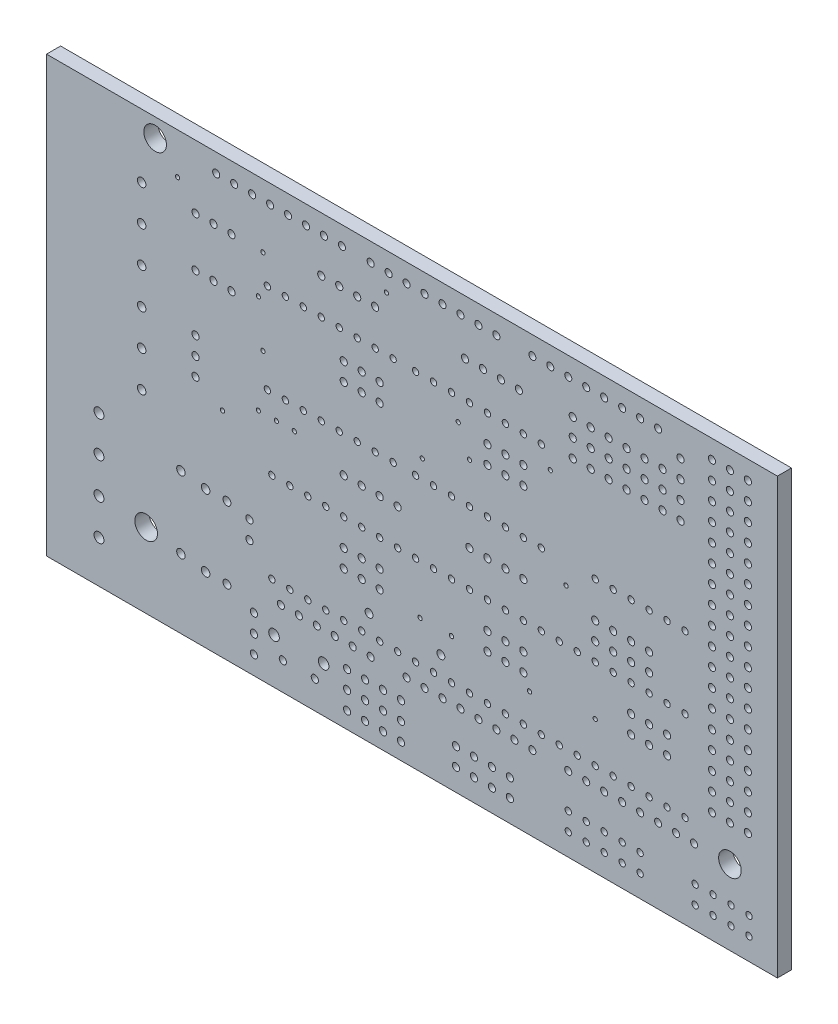
from build123d import *

# Parameters (mm, degrees)
SKETCH1_W           = 131.785247706
SKETCH1_H           = 94.524612159
SKETCH1_R           = 0.510484
SKETCH1_R_2         = 0.5615324
SKETCH1_R_3         = 0.602932652
SKETCH1_R_4         = 0.452212251
SKETCH1_R_5         = 0.7529639
SKETCH1_R_6         = 1.607820406
SKETCH1_R_7         = 0.502443877
SKETCH1_R_8         = 0.7019155
SKETCH1_R_9         = 0.301466326
BOSS_EXTRUDE1_DEPTH = 2
SKETCH4_W           = 136.062514885
SKETCH4_H           = 102.860022968
SKETCH4_W_2         = 103.854835648
SKETCH4_H_2         = 61.764941155
CUT_EXTRUDE1_DEPTH  = 10


with BuildPart() as part:
    # Sketch1 → Boss-Extrude1 (new body)
    with BuildSketch(Plane(origin=(-1.669568433, 0, 0), x_dir=(-1, 0, 0), z_dir=(0, 0, -1))):
        with Locations((-33.736575694, -25.94456792)):
            Rectangle(SKETCH1_W, SKETCH1_H)
        with Locations(Location((-14.63831, -51.3453967, 0), (0, 0, 180))):
            Circle(SKETCH1_R, mode=Mode.SUBTRACT)
        with Locations(Location((-14.000205, -37.600615, 0), (0, 0, 180))):
            Circle(SKETCH1_R, mode=Mode.SUBTRACT)
        with Locations(Location((-14.000205, -40.153035, 0), (0, 0, 180))):
            Circle(SKETCH1_R, mode=Mode.SUBTRACT)
        with Locations(Location((-43.353035, -50.841242702, 0), (0, 0, 180))):
            Circle(SKETCH1_R, mode=Mode.SUBTRACT)
        with Locations(Location((-45.905455, -50.841242702, 0), (0, 0, 180))):
            Circle(SKETCH1_R, mode=Mode.SUBTRACT)
        with Locations(Location((-48.457875, -50.841242702, 0), (0, 0, 180))):
            Circle(SKETCH1_R, mode=Mode.SUBTRACT)
        with Locations(Location((-51.010295, -50.841242702, 0), (0, 0, 180))):
            Circle(SKETCH1_R, mode=Mode.SUBTRACT)
        with Locations(Location((-41.208389619, -40.662217266, 0), (0, 0, 180))):
            Circle(SKETCH1_R_2, mode=Mode.SUBTRACT)
        with Locations(Location((-30.998709619, -40.662217266, 0), (0, 0, 180))):
            Circle(SKETCH1_R_2, mode=Mode.SUBTRACT)
        with Locations(Location((-10.80968, -47.17219, 0), (0, 0, 180))):
            Circle(SKETCH1_R_2, mode=Mode.SUBTRACT)
        with Locations(Location((-10.80968, -36.96251, 0), (0, 0, 180))):
            Circle(SKETCH1_R_2, mode=Mode.SUBTRACT)
        with Locations(Location((-24.209782903, -2.50484, 0), (0, 0, 180))):
            Circle(SKETCH1_R, mode=Mode.SUBTRACT)
        with Locations(Location((-26.762202903, -2.50484, 0), (0, 0, 180))):
            Circle(SKETCH1_R, mode=Mode.SUBTRACT)
        with Locations(Location((-29.314622903, -2.50484, 0), (0, 0, 180))):
            Circle(SKETCH1_R, mode=Mode.SUBTRACT)
        with Locations(Location((-31.867042903, -2.50484, 0), (0, 0, 180))):
            Circle(SKETCH1_R, mode=Mode.SUBTRACT)
        with Locations(Location((-44.629245, -2.50484, 0), (0, 0, 180))):
            Circle(SKETCH1_R, mode=Mode.SUBTRACT)
        with Locations(Location((-47.181665, -2.50484, 0), (0, 0, 180))):
            Circle(SKETCH1_R, mode=Mode.SUBTRACT)
        with Locations(Location((-49.734085, -2.50484, 0), (0, 0, 180))):
            Circle(SKETCH1_R, mode=Mode.SUBTRACT)
        with Locations(Location((-52.286505, -2.50484, 0), (0, 0, 180))):
            Circle(SKETCH1_R, mode=Mode.SUBTRACT)
        with Locations(Location((-7.778732298, -36.96251, 0), (0, 0, 180))):
            Circle(SKETCH1_R_3, mode=Mode.SUBTRACT)
        with Locations(Location((-7.778732298, -47.17219, 0), (0, 0, 180))):
            Circle(SKETCH1_R_3, mode=Mode.SUBTRACT)
        with Locations(Location((-4.269052702, -46.693662298, 0), (0, 0, 180))):
            Circle(SKETCH1_R_3, mode=Mode.SUBTRACT)
        with Locations(Location((-4.269052702, -36.483982298, 0), (0, 0, 180))):
            Circle(SKETCH1_R_3, mode=Mode.SUBTRACT)
        with Locations(Location((-75.258285, -7.131050202, 0), (0, 0, 180))):
            Circle(SKETCH1_R, mode=Mode.SUBTRACT)
        with Locations(Location((-75.258285, -4.578630202, 0), (0, 0, 180))):
            Circle(SKETCH1_R, mode=Mode.SUBTRACT)
        with Locations(Location((-75.258285, -2.026210202, 0), (0, 0, 180))):
            Circle(SKETCH1_R, mode=Mode.SUBTRACT)
        with Locations(Location((-75.258285, 0.526209798, 0), (0, 0, 180))):
            Circle(SKETCH1_R, mode=Mode.SUBTRACT)
        with Locations(Location((-27.40041, -13.99073, 0), (0, 0, 180))):
            Circle(SKETCH1_R, mode=Mode.SUBTRACT)
        with Locations(Location((-27.40041, -11.43831, 0), (0, 0, 180))):
            Circle(SKETCH1_R, mode=Mode.SUBTRACT)
        with Locations(Location((-29.95283, -13.99073, 0), (0, 0, 180))):
            Circle(SKETCH1_R, mode=Mode.SUBTRACT)
        with Locations(Location((-29.95283, -11.43831, 0), (0, 0, 180))):
            Circle(SKETCH1_R, mode=Mode.SUBTRACT)
        with Locations(Location((-32.50525, -13.99073, 0), (0, 0, 180))):
            Circle(SKETCH1_R, mode=Mode.SUBTRACT)
        with Locations(Location((-32.50525, -11.43831, 0), (0, 0, 180))):
            Circle(SKETCH1_R, mode=Mode.SUBTRACT)
        with Locations(Location((-47.81977, -13.99073, 0), (0, 0, 180))):
            Circle(SKETCH1_R, mode=Mode.SUBTRACT)
        with Locations(Location((-47.81977, -11.43831, 0), (0, 0, 180))):
            Circle(SKETCH1_R, mode=Mode.SUBTRACT)
        with Locations(Location((-50.37219, -13.99073, 0), (0, 0, 180))):
            Circle(SKETCH1_R, mode=Mode.SUBTRACT)
        with Locations(Location((-50.37219, -11.43831, 0), (0, 0, 180))):
            Circle(SKETCH1_R, mode=Mode.SUBTRACT)
        with Locations(Location((-52.92461, -13.99073, 0), (0, 0, 180))):
            Circle(SKETCH1_R, mode=Mode.SUBTRACT)
        with Locations(Location((-52.92461, -11.43831, 0), (0, 0, 180))):
            Circle(SKETCH1_R, mode=Mode.SUBTRACT)
        with Locations(Location((-27.40041, -36.96251, 0), (0, 0, 180))):
            Circle(SKETCH1_R, mode=Mode.SUBTRACT)
        with Locations(Location((-27.40041, -34.41009, 0), (0, 0, 180))):
            Circle(SKETCH1_R, mode=Mode.SUBTRACT)
        with Locations(Location((-29.95283, -36.96251, 0), (0, 0, 180))):
            Circle(SKETCH1_R, mode=Mode.SUBTRACT)
        with Locations(Location((-29.95283, -34.41009, 0), (0, 0, 180))):
            Circle(SKETCH1_R, mode=Mode.SUBTRACT)
        with Locations(Location((-32.50525, -36.96251, 0), (0, 0, 180))):
            Circle(SKETCH1_R, mode=Mode.SUBTRACT)
        with Locations(Location((-32.50525, -34.41009, 0), (0, 0, 180))):
            Circle(SKETCH1_R, mode=Mode.SUBTRACT)
        with Locations(Location((-47.81977, -36.96251, 0), (0, 0, 180))):
            Circle(SKETCH1_R, mode=Mode.SUBTRACT)
        with Locations(Location((-47.81977, -34.41009, 0), (0, 0, 180))):
            Circle(SKETCH1_R, mode=Mode.SUBTRACT)
        with Locations(Location((-50.37219, -36.96251, 0), (0, 0, 180))):
            Circle(SKETCH1_R, mode=Mode.SUBTRACT)
        with Locations(Location((-50.37219, -34.41009, 0), (0, 0, 180))):
            Circle(SKETCH1_R, mode=Mode.SUBTRACT)
        with Locations(Location((-52.92461, -36.96251, 0), (0, 0, 180))):
            Circle(SKETCH1_R, mode=Mode.SUBTRACT)
        with Locations(Location((-52.92461, -34.41009, 0), (0, 0, 180))):
            Circle(SKETCH1_R, mode=Mode.SUBTRACT)
        with Locations(Location((-68.23913, -36.96251, 0), (0, 0, 180))):
            Circle(SKETCH1_R, mode=Mode.SUBTRACT)
        with Locations(Location((-68.23913, -34.41009, 0), (0, 0, 180))):
            Circle(SKETCH1_R, mode=Mode.SUBTRACT)
        with Locations(Location((-70.79155, -36.96251, 0), (0, 0, 180))):
            Circle(SKETCH1_R, mode=Mode.SUBTRACT)
        with Locations(Location((-70.79155, -34.41009, 0), (0, 0, 180))):
            Circle(SKETCH1_R, mode=Mode.SUBTRACT)
        with Locations(Location((-73.34397, -36.96251, 0), (0, 0, 180))):
            Circle(SKETCH1_R, mode=Mode.SUBTRACT)
        with Locations(Location((-73.34397, -34.41009, 0), (0, 0, 180))):
            Circle(SKETCH1_R, mode=Mode.SUBTRACT)
        with Locations(Location((-63.13429, -20.37178, 0), (0, 0, 180))):
            Circle(SKETCH1_R_4, mode=Mode.SUBTRACT)
        with Locations(Location((-65.68671, -20.37178, 0), (0, 0, 180))):
            Circle(SKETCH1_R_4, mode=Mode.SUBTRACT)
        with Locations(Location((-68.23913, -20.37178, 0), (0, 0, 180))):
            Circle(SKETCH1_R_4, mode=Mode.SUBTRACT)
        with Locations(Location((-70.79155, -20.37178, 0), (0, 0, 180))):
            Circle(SKETCH1_R_4, mode=Mode.SUBTRACT)
        with Locations(Location((-73.34397, -20.37178, 0), (0, 0, 180))):
            Circle(SKETCH1_R_4, mode=Mode.SUBTRACT)
        with Locations(Location((-75.89639, -20.37178, 0), (0, 0, 180))):
            Circle(SKETCH1_R_4, mode=Mode.SUBTRACT)
        with Locations(Location((-14.63831, -53.8978167, 0), (0, 0, 180))):
            Circle(SKETCH1_R, mode=Mode.SUBTRACT)
        with Locations(Location((-8.895262903, -3.78105, 0), (0, 0, 180))):
            Circle(SKETCH1_R, mode=Mode.SUBTRACT)
        with Locations(Location((-11.447682903, -3.78105, 0), (0, 0, 180))):
            Circle(SKETCH1_R, mode=Mode.SUBTRACT)
        with Locations(Location((-6.342842903, -3.78105, 0), (0, 0, 180))):
            Circle(SKETCH1_R, mode=Mode.SUBTRACT)
        with Locations(Location((-8.895262903, -10.800307097, 0), (0, 0, 180))):
            Circle(SKETCH1_R, mode=Mode.SUBTRACT)
        with Locations(Location((-11.447682903, -10.800307097, 0), (0, 0, 180))):
            Circle(SKETCH1_R, mode=Mode.SUBTRACT)
        with Locations(Location((-6.342842903, -10.800307097, 0), (0, 0, 180))):
            Circle(SKETCH1_R, mode=Mode.SUBTRACT)
        with Locations(Location((-6.343047097, -21.3289375, 0), (0, 0, 180))):
            Circle(SKETCH1_R, mode=Mode.SUBTRACT)
        with Locations(Location((-6.343047097, -23.8813575, 0), (0, 0, 180))):
            Circle(SKETCH1_R, mode=Mode.SUBTRACT)
        with Locations(Location((-6.343047097, -18.7765175, 0), (0, 0, 180))):
            Circle(SKETCH1_R, mode=Mode.SUBTRACT)
        with Locations(Location((-18.7477062, -52.5705583, 0), (0, 0, 180))):
            Circle(SKETCH1_R, mode=Mode.SUBTRACT)
        with Locations(Location((-23.2910138, -52.5705583, 0), (0, 0, 180))):
            Circle(SKETCH1_R, mode=Mode.SUBTRACT)
        with Locations(Location((-17.4970204, -50.0691867, 0), (0, 0, 180))):
            Circle(SKETCH1_R_5, mode=Mode.SUBTRACT)
        with Locations(Location((-24.5416996, -50.0691867, 0), (0, 0, 180))):
            Circle(SKETCH1_R_5, mode=Mode.SUBTRACT)
        with Locations(Location((-27.878937702, -54.191447097, 0), (0, 0, 180))):
            Circle(SKETCH1_R, mode=Mode.SUBTRACT)
        with Locations(Location((-27.878937702, -51.639027097, 0), (0, 0, 180))):
            Circle(SKETCH1_R, mode=Mode.SUBTRACT)
        with Locations(Location((-27.878937702, -49.086607097, 0), (0, 0, 180))):
            Circle(SKETCH1_R, mode=Mode.SUBTRACT)
        with Locations(Location((-30.431459798, -54.191345, 0), (0, 0, 180))):
            Circle(SKETCH1_R, mode=Mode.SUBTRACT)
        with Locations(Location((-30.431459798, -51.638925, 0), (0, 0, 180))):
            Circle(SKETCH1_R, mode=Mode.SUBTRACT)
        with Locations(Location((-30.431459798, -49.086505, 0), (0, 0, 180))):
            Circle(SKETCH1_R, mode=Mode.SUBTRACT)
        with Locations(Location((-32.983777702, -54.191345, 0), (0, 0, 180))):
            Circle(SKETCH1_R, mode=Mode.SUBTRACT)
        with Locations(Location((-32.983777702, -51.638925, 0), (0, 0, 180))):
            Circle(SKETCH1_R, mode=Mode.SUBTRACT)
        with Locations(Location((-32.983777702, -49.086505, 0), (0, 0, 180))):
            Circle(SKETCH1_R, mode=Mode.SUBTRACT)
        with Locations(Location((-35.536299798, -54.191345, 0), (0, 0, 180))):
            Circle(SKETCH1_R, mode=Mode.SUBTRACT)
        with Locations(Location((-35.536299798, -51.638925, 0), (0, 0, 180))):
            Circle(SKETCH1_R, mode=Mode.SUBTRACT)
        with Locations(Location((-35.536299798, -49.086505, 0), (0, 0, 180))):
            Circle(SKETCH1_R, mode=Mode.SUBTRACT)
        with Locations(Location((-43.353035, -53.393764798, 0), (0, 0, 180))):
            Circle(SKETCH1_R, mode=Mode.SUBTRACT)
        with Locations(Location((-45.905455, -53.393764798, 0), (0, 0, 180))):
            Circle(SKETCH1_R, mode=Mode.SUBTRACT)
        with Locations(Location((-48.457875, -53.393764798, 0), (0, 0, 180))):
            Circle(SKETCH1_R, mode=Mode.SUBTRACT)
        with Locations(Location((-51.010295, -53.393764798, 0), (0, 0, 180))):
            Circle(SKETCH1_R, mode=Mode.SUBTRACT)
        with Locations(Location((1.314315, -29.30525, 0), (0, 0, 180))):
            Circle(SKETCH1_R_3, mode=Mode.SUBTRACT)
        with Locations(Location((1.314315, -24.20041, 0), (0, 0, 180))):
            Circle(SKETCH1_R_3, mode=Mode.SUBTRACT)
        with Locations(Location((1.314315, -19.09557, 0), (0, 0, 180))):
            Circle(SKETCH1_R_3, mode=Mode.SUBTRACT)
        with Locations(Location((1.314315, -13.99073, 0), (0, 0, 180))):
            Circle(SKETCH1_R_3, mode=Mode.SUBTRACT)
        with Locations(Location((1.314315, -8.88589, 0), (0, 0, 180))):
            Circle(SKETCH1_R_3, mode=Mode.SUBTRACT)
        with Locations(Location((1.314315, -3.78105, 0), (0, 0, 180))):
            Circle(SKETCH1_R_3, mode=Mode.SUBTRACT)
        with Locations(Location((-84.989335202, -50.841242702, 0), (0, 0, 180))):
            Circle(SKETCH1_R_4, mode=Mode.SUBTRACT)
        with Locations(Location((-84.989335202, -53.393662702, 0), (0, 0, 180))):
            Circle(SKETCH1_R_4, mode=Mode.SUBTRACT)
        with Locations(Location((-82.436915202, -50.841242702, 0), (0, 0, 180))):
            Circle(SKETCH1_R_4, mode=Mode.SUBTRACT)
        with Locations(Location((-82.436915202, -53.393662702, 0), (0, 0, 180))):
            Circle(SKETCH1_R_4, mode=Mode.SUBTRACT)
        with Locations(Location((-79.884495202, -50.841242702, 0), (0, 0, 180))):
            Circle(SKETCH1_R_4, mode=Mode.SUBTRACT)
        with Locations(Location((-79.884495202, -53.393662702, 0), (0, 0, 180))):
            Circle(SKETCH1_R_4, mode=Mode.SUBTRACT)
        with Locations(Location((-77.332075202, -50.841242702, 0), (0, 0, 180))):
            Circle(SKETCH1_R_4, mode=Mode.SUBTRACT)
        with Locations(Location((-77.332075202, -53.393662702, 0), (0, 0, 180))):
            Circle(SKETCH1_R_4, mode=Mode.SUBTRACT)
        with Locations(Location((-26.762305, -7.60968, 0), (0, 0, 180))):
            Circle(SKETCH1_R_4, mode=Mode.SUBTRACT)
        with Locations(Location((-29.314725, -7.60968, 0), (0, 0, 180))):
            Circle(SKETCH1_R_4, mode=Mode.SUBTRACT)
        with Locations(Location((-24.209885, -7.60968, 0), (0, 0, 180))):
            Circle(SKETCH1_R_4, mode=Mode.SUBTRACT)
        with Locations(Location((-21.657465, -7.60968, 0), (0, 0, 180))):
            Circle(SKETCH1_R_4, mode=Mode.SUBTRACT)
        with Locations(Location((-34.419565, -20.37178, 0), (0, 0, 180))):
            Circle(SKETCH1_R_4, mode=Mode.SUBTRACT)
        with Locations(Location((-16.552625, -20.37178, 0), (0, 0, 180))):
            Circle(SKETCH1_R_4, mode=Mode.SUBTRACT)
        with Locations(Location((-34.419565, -7.60968, 0), (0, 0, 180))):
            Circle(SKETCH1_R_4, mode=Mode.SUBTRACT)
        with Locations(Location((-19.105045, -7.60968, 0), (0, 0, 180))):
            Circle(SKETCH1_R_4, mode=Mode.SUBTRACT)
        with Locations(Location((-19.105045, -20.37178, 0), (0, 0, 180))):
            Circle(SKETCH1_R_4, mode=Mode.SUBTRACT)
        with Locations(Location((-21.657465, -20.37178, 0), (0, 0, 180))):
            Circle(SKETCH1_R_4, mode=Mode.SUBTRACT)
        with Locations(Location((-24.209885, -20.37178, 0), (0, 0, 180))):
            Circle(SKETCH1_R_4, mode=Mode.SUBTRACT)
        with Locations(Location((-26.762305, -20.37178, 0), (0, 0, 180))):
            Circle(SKETCH1_R_4, mode=Mode.SUBTRACT)
        with Locations(Location((-29.314725, -20.37178, 0), (0, 0, 180))):
            Circle(SKETCH1_R_4, mode=Mode.SUBTRACT)
        with Locations(Location((-31.867145, -20.37178, 0), (0, 0, 180))):
            Circle(SKETCH1_R_4, mode=Mode.SUBTRACT)
        with Locations(Location((-31.867145, -7.60968, 0), (0, 0, 180))):
            Circle(SKETCH1_R_4, mode=Mode.SUBTRACT)
        with Locations(Location((-16.552625, -7.60968, 0), (0, 0, 180))):
            Circle(SKETCH1_R_4, mode=Mode.SUBTRACT)
        with Locations(Location((-47.81977, -7.60968, 0), (0, 0, 180))):
            Circle(SKETCH1_R_4, mode=Mode.SUBTRACT)
        with Locations(Location((-50.37219, -7.60968, 0), (0, 0, 180))):
            Circle(SKETCH1_R_4, mode=Mode.SUBTRACT)
        with Locations(Location((-45.26735, -7.60968, 0), (0, 0, 180))):
            Circle(SKETCH1_R_4, mode=Mode.SUBTRACT)
        with Locations(Location((-42.71493, -7.60968, 0), (0, 0, 180))):
            Circle(SKETCH1_R_4, mode=Mode.SUBTRACT)
        with Locations(Location((-55.47703, -20.37178, 0), (0, 0, 180))):
            Circle(SKETCH1_R_4, mode=Mode.SUBTRACT)
        with Locations(Location((-37.61009, -20.37178, 0), (0, 0, 180))):
            Circle(SKETCH1_R_4, mode=Mode.SUBTRACT)
        with Locations(Location((-55.47703, -7.60968, 0), (0, 0, 180))):
            Circle(SKETCH1_R_4, mode=Mode.SUBTRACT)
        with Locations(Location((-40.16251, -7.60968, 0), (0, 0, 180))):
            Circle(SKETCH1_R_4, mode=Mode.SUBTRACT)
        with Locations(Location((-40.16251, -20.37178, 0), (0, 0, 180))):
            Circle(SKETCH1_R_4, mode=Mode.SUBTRACT)
        with Locations(Location((-42.71493, -20.37178, 0), (0, 0, 180))):
            Circle(SKETCH1_R_4, mode=Mode.SUBTRACT)
        with Locations(Location((-45.26735, -20.37178, 0), (0, 0, 180))):
            Circle(SKETCH1_R_4, mode=Mode.SUBTRACT)
        with Locations(Location((-47.81977, -20.37178, 0), (0, 0, 180))):
            Circle(SKETCH1_R_4, mode=Mode.SUBTRACT)
        with Locations(Location((-50.37219, -20.37178, 0), (0, 0, 180))):
            Circle(SKETCH1_R_4, mode=Mode.SUBTRACT)
        with Locations(Location((-52.92461, -20.37178, 0), (0, 0, 180))):
            Circle(SKETCH1_R_4, mode=Mode.SUBTRACT)
        with Locations(Location((-52.92461, -7.60968, 0), (0, 0, 180))):
            Circle(SKETCH1_R_4, mode=Mode.SUBTRACT)
        with Locations(Location((-37.61009, -7.60968, 0), (0, 0, 180))):
            Circle(SKETCH1_R_4, mode=Mode.SUBTRACT)
        with Locations(Location((-27.400512097, -30.58146, 0), (0, 0, 180))):
            Circle(SKETCH1_R_4, mode=Mode.SUBTRACT)
        with Locations(Location((-29.952932097, -30.58146, 0), (0, 0, 180))):
            Circle(SKETCH1_R_4, mode=Mode.SUBTRACT)
        with Locations(Location((-24.848092097, -30.58146, 0), (0, 0, 180))):
            Circle(SKETCH1_R_4, mode=Mode.SUBTRACT)
        with Locations(Location((-22.295672097, -30.58146, 0), (0, 0, 180))):
            Circle(SKETCH1_R_4, mode=Mode.SUBTRACT)
        with Locations(Location((-35.057772097, -43.34356, 0), (0, 0, 180))):
            Circle(SKETCH1_R_4, mode=Mode.SUBTRACT)
        with Locations(Location((-17.190832097, -43.34356, 0), (0, 0, 180))):
            Circle(SKETCH1_R_4, mode=Mode.SUBTRACT)
        with Locations(Location((-35.057772097, -30.58146, 0), (0, 0, 180))):
            Circle(SKETCH1_R_4, mode=Mode.SUBTRACT)
        with Locations(Location((-19.743252097, -30.58146, 0), (0, 0, 180))):
            Circle(SKETCH1_R_4, mode=Mode.SUBTRACT)
        with Locations(Location((-19.743252097, -43.34356, 0), (0, 0, 180))):
            Circle(SKETCH1_R_4, mode=Mode.SUBTRACT)
        with Locations(Location((-22.295672097, -43.34356, 0), (0, 0, 180))):
            Circle(SKETCH1_R_4, mode=Mode.SUBTRACT)
        with Locations(Location((-24.848092097, -43.34356, 0), (0, 0, 180))):
            Circle(SKETCH1_R_4, mode=Mode.SUBTRACT)
        with Locations(Location((-27.400512097, -43.34356, 0), (0, 0, 180))):
            Circle(SKETCH1_R_4, mode=Mode.SUBTRACT)
        with Locations(Location((-29.952932097, -43.34356, 0), (0, 0, 180))):
            Circle(SKETCH1_R_4, mode=Mode.SUBTRACT)
        with Locations(Location((-32.505352097, -43.34356, 0), (0, 0, 180))):
            Circle(SKETCH1_R_4, mode=Mode.SUBTRACT)
        with Locations(Location((-32.505352097, -30.58146, 0), (0, 0, 180))):
            Circle(SKETCH1_R_4, mode=Mode.SUBTRACT)
        with Locations(Location((-17.190832097, -30.58146, 0), (0, 0, 180))):
            Circle(SKETCH1_R_4, mode=Mode.SUBTRACT)
        with Locations(Location((-47.81977, -30.58146, 0), (0, 0, 180))):
            Circle(SKETCH1_R_4, mode=Mode.SUBTRACT)
        with Locations(Location((-50.37219, -30.58146, 0), (0, 0, 180))):
            Circle(SKETCH1_R_4, mode=Mode.SUBTRACT)
        with Locations(Location((-45.26735, -30.58146, 0), (0, 0, 180))):
            Circle(SKETCH1_R_4, mode=Mode.SUBTRACT)
        with Locations(Location((-42.71493, -30.58146, 0), (0, 0, 180))):
            Circle(SKETCH1_R_4, mode=Mode.SUBTRACT)
        with Locations(Location((-55.47703, -43.34356, 0), (0, 0, 180))):
            Circle(SKETCH1_R_4, mode=Mode.SUBTRACT)
        with Locations(Location((-37.61009, -43.34356, 0), (0, 0, 180))):
            Circle(SKETCH1_R_4, mode=Mode.SUBTRACT)
        with Locations(Location((-55.47703, -30.58146, 0), (0, 0, 180))):
            Circle(SKETCH1_R_4, mode=Mode.SUBTRACT)
        with Locations(Location((-40.16251, -30.58146, 0), (0, 0, 180))):
            Circle(SKETCH1_R_4, mode=Mode.SUBTRACT)
        with Locations(Location((-40.16251, -43.34356, 0), (0, 0, 180))):
            Circle(SKETCH1_R_4, mode=Mode.SUBTRACT)
        with Locations(Location((-42.71493, -43.34356, 0), (0, 0, 180))):
            Circle(SKETCH1_R_4, mode=Mode.SUBTRACT)
        with Locations(Location((-45.26735, -43.34356, 0), (0, 0, 180))):
            Circle(SKETCH1_R_4, mode=Mode.SUBTRACT)
        with Locations(Location((-47.81977, -43.34356, 0), (0, 0, 180))):
            Circle(SKETCH1_R_4, mode=Mode.SUBTRACT)
        with Locations(Location((-50.37219, -43.34356, 0), (0, 0, 180))):
            Circle(SKETCH1_R_4, mode=Mode.SUBTRACT)
        with Locations(Location((-52.92461, -43.34356, 0), (0, 0, 180))):
            Circle(SKETCH1_R_4, mode=Mode.SUBTRACT)
        with Locations(Location((-52.92461, -30.58146, 0), (0, 0, 180))):
            Circle(SKETCH1_R_4, mode=Mode.SUBTRACT)
        with Locations(Location((-37.61009, -30.58146, 0), (0, 0, 180))):
            Circle(SKETCH1_R_4, mode=Mode.SUBTRACT)
        with Locations(Location((-68.23913, -30.58146, 0), (0, 0, 180))):
            Circle(SKETCH1_R_4, mode=Mode.SUBTRACT)
        with Locations(Location((-70.79155, -30.58146, 0), (0, 0, 180))):
            Circle(SKETCH1_R_4, mode=Mode.SUBTRACT)
        with Locations(Location((-65.68671, -30.58146, 0), (0, 0, 180))):
            Circle(SKETCH1_R_4, mode=Mode.SUBTRACT)
        with Locations(Location((-63.13429, -30.58146, 0), (0, 0, 180))):
            Circle(SKETCH1_R_4, mode=Mode.SUBTRACT)
        with Locations(Location((-75.89639, -43.34356, 0), (0, 0, 180))):
            Circle(SKETCH1_R_4, mode=Mode.SUBTRACT)
        with Locations(Location((-58.02945, -43.34356, 0), (0, 0, 180))):
            Circle(SKETCH1_R_4, mode=Mode.SUBTRACT)
        with Locations(Location((-75.89639, -30.58146, 0), (0, 0, 180))):
            Circle(SKETCH1_R_4, mode=Mode.SUBTRACT)
        with Locations(Location((-60.58187, -30.58146, 0), (0, 0, 180))):
            Circle(SKETCH1_R_4, mode=Mode.SUBTRACT)
        with Locations(Location((-60.58187, -43.34356, 0), (0, 0, 180))):
            Circle(SKETCH1_R_4, mode=Mode.SUBTRACT)
        with Locations(Location((-63.13429, -43.34356, 0), (0, 0, 180))):
            Circle(SKETCH1_R_4, mode=Mode.SUBTRACT)
        with Locations(Location((-65.68671, -43.34356, 0), (0, 0, 180))):
            Circle(SKETCH1_R_4, mode=Mode.SUBTRACT)
        with Locations(Location((-68.23913, -43.34356, 0), (0, 0, 180))):
            Circle(SKETCH1_R_4, mode=Mode.SUBTRACT)
        with Locations(Location((-70.79155, -43.34356, 0), (0, 0, 180))):
            Circle(SKETCH1_R_4, mode=Mode.SUBTRACT)
        with Locations(Location((-73.34397, -43.34356, 0), (0, 0, 180))):
            Circle(SKETCH1_R_4, mode=Mode.SUBTRACT)
        with Locations(Location((-73.34397, -30.58146, 0), (0, 0, 180))):
            Circle(SKETCH1_R_4, mode=Mode.SUBTRACT)
        with Locations(Location((-58.02945, -30.58146, 0), (0, 0, 180))):
            Circle(SKETCH1_R_4, mode=Mode.SUBTRACT)
        with Locations(Location((-84.82986, -40.79114, 0), (0, 0, 180))):
            Circle(SKETCH1_R, mode=Mode.SUBTRACT)
        with Locations(Location((-84.82986, -38.23872, 0), (0, 0, 180))):
            Circle(SKETCH1_R, mode=Mode.SUBTRACT)
        with Locations(Location((-84.82986, -35.6863, 0), (0, 0, 180))):
            Circle(SKETCH1_R, mode=Mode.SUBTRACT)
        with Locations(Location((-84.82986, -33.13388, 0), (0, 0, 180))):
            Circle(SKETCH1_R, mode=Mode.SUBTRACT)
        with Locations(Location((-84.82986, -30.58146, 0), (0, 0, 180))):
            Circle(SKETCH1_R, mode=Mode.SUBTRACT)
        with Locations(Location((-84.82986, -28.02904, 0), (0, 0, 180))):
            Circle(SKETCH1_R, mode=Mode.SUBTRACT)
        with Locations(Location((-84.82986, -25.47662, 0), (0, 0, 180))):
            Circle(SKETCH1_R, mode=Mode.SUBTRACT)
        with Locations(Location((-84.82986, -22.9242, 0), (0, 0, 180))):
            Circle(SKETCH1_R, mode=Mode.SUBTRACT)
        with Locations(Location((-84.82986, -20.37178, 0), (0, 0, 180))):
            Circle(SKETCH1_R, mode=Mode.SUBTRACT)
        with Locations(Location((-84.82986, -17.81936, 0), (0, 0, 180))):
            Circle(SKETCH1_R, mode=Mode.SUBTRACT)
        with Locations(Location((-84.82986, -15.26694, 0), (0, 0, 180))):
            Circle(SKETCH1_R, mode=Mode.SUBTRACT)
        with Locations(Location((-84.82986, -12.71452, 0), (0, 0, 180))):
            Circle(SKETCH1_R, mode=Mode.SUBTRACT)
        with Locations(Location((-84.82986, -10.1621, 0), (0, 0, 180))):
            Circle(SKETCH1_R, mode=Mode.SUBTRACT)
        with Locations(Location((-84.82986, -7.60968, 0), (0, 0, 180))):
            Circle(SKETCH1_R, mode=Mode.SUBTRACT)
        with Locations(Location((-84.82986, -5.05726, 0), (0, 0, 180))):
            Circle(SKETCH1_R, mode=Mode.SUBTRACT)
        with Locations(Location((-84.82986, -2.50484, 0), (0, 0, 180))):
            Circle(SKETCH1_R, mode=Mode.SUBTRACT)
        with Locations(Location((-84.82986, 0.04758, 0), (0, 0, 180))):
            Circle(SKETCH1_R, mode=Mode.SUBTRACT)
        with Locations(Location((-84.82986, 2.6, 0), (0, 0, 180))):
            Circle(SKETCH1_R, mode=Mode.SUBTRACT)
        with Locations(Location((-59.30566, -53.393662702, 0), (0, 0, 180))):
            Circle(SKETCH1_R_4, mode=Mode.SUBTRACT)
        with Locations(Location((-59.30566, -50.841242702, 0), (0, 0, 180))):
            Circle(SKETCH1_R_4, mode=Mode.SUBTRACT)
        with Locations(Location((-61.85808, -53.393662702, 0), (0, 0, 180))):
            Circle(SKETCH1_R_4, mode=Mode.SUBTRACT)
        with Locations(Location((-61.85808, -50.841242702, 0), (0, 0, 180))):
            Circle(SKETCH1_R_4, mode=Mode.SUBTRACT)
        with Locations(Location((-64.4105, -53.393662702, 0), (0, 0, 180))):
            Circle(SKETCH1_R_4, mode=Mode.SUBTRACT)
        with Locations(Location((-64.4105, -50.841242702, 0), (0, 0, 180))):
            Circle(SKETCH1_R_4, mode=Mode.SUBTRACT)
        with Locations(Location((-66.96292, -53.393662702, 0), (0, 0, 180))):
            Circle(SKETCH1_R_4, mode=Mode.SUBTRACT)
        with Locations(Location((-66.96292, -50.841242702, 0), (0, 0, 180))):
            Circle(SKETCH1_R_4, mode=Mode.SUBTRACT)
        with Locations(Location((-69.51534, -53.393662702, 0), (0, 0, 180))):
            Circle(SKETCH1_R_4, mode=Mode.SUBTRACT)
        with Locations(Location((-69.51534, -50.841242702, 0), (0, 0, 180))):
            Circle(SKETCH1_R_4, mode=Mode.SUBTRACT)
        with Locations(Location((-82.27744, -45.89598, 0), (0, 0, 180))):
            Circle(SKETCH1_R_6, mode=Mode.SUBTRACT)
        with Locations(Location((0.67621, -45.89598, 0), (0, 0, 180))):
            Circle(SKETCH1_R_6, mode=Mode.SUBTRACT)
        with Locations(Location((-0.6, 2.6, 0), (0, 0, 180))):
            Circle(SKETCH1_R_6, mode=Mode.SUBTRACT)
        with Locations(Location((-21.01936, -45.89598, 0), (0, 0, 180))):
            Circle(SKETCH1_R_7, mode=Mode.SUBTRACT)
        with Locations(Location((-23.57178, -45.89598, 0), (0, 0, 180))):
            Circle(SKETCH1_R_7, mode=Mode.SUBTRACT)
        with Locations(Location((-79.72502, 2.6, 0), (0, 0, 180))):
            Circle(SKETCH1_R_7, mode=Mode.SUBTRACT)
        with Locations(Location((-82.27744, 2.6, 0), (0, 0, 180))):
            Circle(SKETCH1_R_7, mode=Mode.SUBTRACT)
        with Locations(Location((-36.33388, -45.89598, 0), (0, 0, 180))):
            Circle(SKETCH1_R_7, mode=Mode.SUBTRACT)
        with Locations(Location((-38.8863, -45.89598, 0), (0, 0, 180))):
            Circle(SKETCH1_R_7, mode=Mode.SUBTRACT)
        with Locations(Location((-41.43872, -45.89598, 0), (0, 0, 180))):
            Circle(SKETCH1_R_7, mode=Mode.SUBTRACT)
        with Locations(Location((-43.99114, -45.89598, 0), (0, 0, 180))):
            Circle(SKETCH1_R_7, mode=Mode.SUBTRACT)
        with Locations(Location((-46.54356, -45.89598, 0), (0, 0, 180))):
            Circle(SKETCH1_R_7, mode=Mode.SUBTRACT)
        with Locations(Location((-49.09598, -45.89598, 0), (0, 0, 180))):
            Circle(SKETCH1_R_7, mode=Mode.SUBTRACT)
        with Locations(Location((-51.6484, -45.89598, 0), (0, 0, 180))):
            Circle(SKETCH1_R_7, mode=Mode.SUBTRACT)
        with Locations(Location((-54.20082, -45.89598, 0), (0, 0, 180))):
            Circle(SKETCH1_R_7, mode=Mode.SUBTRACT)
        with Locations(Location((-59.30566, -45.89598, 0), (0, 0, 180))):
            Circle(SKETCH1_R_7, mode=Mode.SUBTRACT)
        with Locations(Location((-61.85808, -45.89598, 0), (0, 0, 180))):
            Circle(SKETCH1_R_7, mode=Mode.SUBTRACT)
        with Locations(Location((-64.4105, -45.89598, 0), (0, 0, 180))):
            Circle(SKETCH1_R_7, mode=Mode.SUBTRACT)
        with Locations(Location((-66.96292, -45.89598, 0), (0, 0, 180))):
            Circle(SKETCH1_R_7, mode=Mode.SUBTRACT)
        with Locations(Location((-69.51534, -45.89598, 0), (0, 0, 180))):
            Circle(SKETCH1_R_7, mode=Mode.SUBTRACT)
        with Locations(Location((-72.06776, -45.89598, 0), (0, 0, 180))):
            Circle(SKETCH1_R_7, mode=Mode.SUBTRACT)
        with Locations(Location((-74.62018, -45.89598, 0), (0, 0, 180))):
            Circle(SKETCH1_R_7, mode=Mode.SUBTRACT)
        with Locations(Location((-77.1726, -45.89598, 0), (0, 0, 180))):
            Circle(SKETCH1_R_7, mode=Mode.SUBTRACT)
        with Locations(Location((-9.278228, 2.6, 0), (0, 0, 180))):
            Circle(SKETCH1_R_7, mode=Mode.SUBTRACT)
        with Locations(Location((-43.99114, 2.6, 0), (0, 0, 180))):
            Circle(SKETCH1_R_7, mode=Mode.SUBTRACT)
        with Locations(Location((-41.43872, 2.6, 0), (0, 0, 180))):
            Circle(SKETCH1_R_7, mode=Mode.SUBTRACT)
        with Locations(Location((-38.8863, 2.6, 0), (0, 0, 180))):
            Circle(SKETCH1_R_7, mode=Mode.SUBTRACT)
        with Locations(Location((-36.33388, 2.6, 0), (0, 0, 180))):
            Circle(SKETCH1_R_7, mode=Mode.SUBTRACT)
        with Locations(Location((-33.78146, 2.6, 0), (0, 0, 180))):
            Circle(SKETCH1_R_7, mode=Mode.SUBTRACT)
        with Locations(Location((-31.22904, 2.6, 0), (0, 0, 180))):
            Circle(SKETCH1_R_7, mode=Mode.SUBTRACT)
        with Locations(Location((-27.145168, 2.6, 0), (0, 0, 180))):
            Circle(SKETCH1_R_7, mode=Mode.SUBTRACT)
        with Locations(Location((-24.592748, 2.6, 0), (0, 0, 180))):
            Circle(SKETCH1_R_7, mode=Mode.SUBTRACT)
        with Locations(Location((-22.040328, 2.6, 0), (0, 0, 180))):
            Circle(SKETCH1_R_7, mode=Mode.SUBTRACT)
        with Locations(Location((-19.487908, 2.6, 0), (0, 0, 180))):
            Circle(SKETCH1_R_7, mode=Mode.SUBTRACT)
        with Locations(Location((-16.935488, 2.6, 0), (0, 0, 180))):
            Circle(SKETCH1_R_7, mode=Mode.SUBTRACT)
        with Locations(Location((-14.383068, 2.6, 0), (0, 0, 180))):
            Circle(SKETCH1_R_7, mode=Mode.SUBTRACT)
        with Locations(Location((-54.20082, 2.6, 0), (0, 0, 180))):
            Circle(SKETCH1_R_7, mode=Mode.SUBTRACT)
        with Locations(Location((-56.75324, 2.6, 0), (0, 0, 180))):
            Circle(SKETCH1_R_7, mode=Mode.SUBTRACT)
        with Locations(Location((-59.30566, 2.6, 0), (0, 0, 180))):
            Circle(SKETCH1_R_7, mode=Mode.SUBTRACT)
        with Locations(Location((-61.85808, 2.6, 0), (0, 0, 180))):
            Circle(SKETCH1_R_7, mode=Mode.SUBTRACT)
        with Locations(Location((-64.4105, 2.6, 0), (0, 0, 180))):
            Circle(SKETCH1_R_7, mode=Mode.SUBTRACT)
        with Locations(Location((-66.96292, 2.6, 0), (0, 0, 180))):
            Circle(SKETCH1_R_7, mode=Mode.SUBTRACT)
        with Locations(Location((-69.51534, 2.6, 0), (0, 0, 180))):
            Circle(SKETCH1_R_7, mode=Mode.SUBTRACT)
        with Locations(Location((-72.06776, 2.6, 0), (0, 0, 180))):
            Circle(SKETCH1_R_7, mode=Mode.SUBTRACT)
        with Locations(Location((-79.72502, 0.04758, 0), (0, 0, 180))):
            Circle(SKETCH1_R_7, mode=Mode.SUBTRACT)
        with Locations(Location((-82.27744, 0.04758, 0), (0, 0, 180))):
            Circle(SKETCH1_R_7, mode=Mode.SUBTRACT)
        with Locations(Location((-79.72502, -2.50484, 0), (0, 0, 180))):
            Circle(SKETCH1_R_7, mode=Mode.SUBTRACT)
        with Locations(Location((-82.27744, -2.50484, 0), (0, 0, 180))):
            Circle(SKETCH1_R_7, mode=Mode.SUBTRACT)
        with Locations(Location((-79.72502, -5.05726, 0), (0, 0, 180))):
            Circle(SKETCH1_R_7, mode=Mode.SUBTRACT)
        with Locations(Location((-82.27744, -5.05726, 0), (0, 0, 180))):
            Circle(SKETCH1_R_7, mode=Mode.SUBTRACT)
        with Locations(Location((-79.72502, -7.60968, 0), (0, 0, 180))):
            Circle(SKETCH1_R_7, mode=Mode.SUBTRACT)
        with Locations(Location((-82.27744, -7.60968, 0), (0, 0, 180))):
            Circle(SKETCH1_R_7, mode=Mode.SUBTRACT)
        with Locations(Location((-79.72502, -10.1621, 0), (0, 0, 180))):
            Circle(SKETCH1_R_7, mode=Mode.SUBTRACT)
        with Locations(Location((-82.27744, -10.1621, 0), (0, 0, 180))):
            Circle(SKETCH1_R_7, mode=Mode.SUBTRACT)
        with Locations(Location((-79.72502, -12.71452, 0), (0, 0, 180))):
            Circle(SKETCH1_R_7, mode=Mode.SUBTRACT)
        with Locations(Location((-82.27744, -12.71452, 0), (0, 0, 180))):
            Circle(SKETCH1_R_7, mode=Mode.SUBTRACT)
        with Locations(Location((-79.72502, -15.26694, 0), (0, 0, 180))):
            Circle(SKETCH1_R_7, mode=Mode.SUBTRACT)
        with Locations(Location((-82.27744, -15.26694, 0), (0, 0, 180))):
            Circle(SKETCH1_R_7, mode=Mode.SUBTRACT)
        with Locations(Location((-79.72502, -17.81936, 0), (0, 0, 180))):
            Circle(SKETCH1_R_7, mode=Mode.SUBTRACT)
        with Locations(Location((-82.27744, -17.81936, 0), (0, 0, 180))):
            Circle(SKETCH1_R_7, mode=Mode.SUBTRACT)
        with Locations(Location((-79.72502, -20.37178, 0), (0, 0, 180))):
            Circle(SKETCH1_R_7, mode=Mode.SUBTRACT)
        with Locations(Location((-82.27744, -20.37178, 0), (0, 0, 180))):
            Circle(SKETCH1_R_7, mode=Mode.SUBTRACT)
        with Locations(Location((-79.72502, -22.9242, 0), (0, 0, 180))):
            Circle(SKETCH1_R_7, mode=Mode.SUBTRACT)
        with Locations(Location((-82.27744, -22.9242, 0), (0, 0, 180))):
            Circle(SKETCH1_R_7, mode=Mode.SUBTRACT)
        with Locations(Location((-79.72502, -25.47662, 0), (0, 0, 180))):
            Circle(SKETCH1_R_7, mode=Mode.SUBTRACT)
        with Locations(Location((-82.27744, -25.47662, 0), (0, 0, 180))):
            Circle(SKETCH1_R_7, mode=Mode.SUBTRACT)
        with Locations(Location((-79.72502, -28.02904, 0), (0, 0, 180))):
            Circle(SKETCH1_R_7, mode=Mode.SUBTRACT)
        with Locations(Location((-82.27744, -28.02904, 0), (0, 0, 180))):
            Circle(SKETCH1_R_7, mode=Mode.SUBTRACT)
        with Locations(Location((-79.72502, -30.58146, 0), (0, 0, 180))):
            Circle(SKETCH1_R_7, mode=Mode.SUBTRACT)
        with Locations(Location((-82.27744, -30.58146, 0), (0, 0, 180))):
            Circle(SKETCH1_R_7, mode=Mode.SUBTRACT)
        with Locations(Location((-79.72502, -33.13388, 0), (0, 0, 180))):
            Circle(SKETCH1_R_7, mode=Mode.SUBTRACT)
        with Locations(Location((-82.27744, -33.13388, 0), (0, 0, 180))):
            Circle(SKETCH1_R_7, mode=Mode.SUBTRACT)
        with Locations(Location((-79.72502, -35.6863, 0), (0, 0, 180))):
            Circle(SKETCH1_R_7, mode=Mode.SUBTRACT)
        with Locations(Location((-82.27744, -35.6863, 0), (0, 0, 180))):
            Circle(SKETCH1_R_7, mode=Mode.SUBTRACT)
        with Locations(Location((-79.72502, -38.23872, 0), (0, 0, 180))):
            Circle(SKETCH1_R_7, mode=Mode.SUBTRACT)
        with Locations(Location((-82.27744, -38.23872, 0), (0, 0, 180))):
            Circle(SKETCH1_R_7, mode=Mode.SUBTRACT)
        with Locations(Location((-26.1242, -45.89598, 0), (0, 0, 180))):
            Circle(SKETCH1_R_7, mode=Mode.SUBTRACT)
        with Locations(Location((-28.67662, -45.89598, 0), (0, 0, 180))):
            Circle(SKETCH1_R_7, mode=Mode.SUBTRACT)
        with Locations(Location((-11.830648, 2.6, 0), (0, 0, 180))):
            Circle(SKETCH1_R_7, mode=Mode.SUBTRACT)
        with Locations(Location((-79.72502, -40.79114, 0), (0, 0, 180))):
            Circle(SKETCH1_R_7, mode=Mode.SUBTRACT)
        with Locations(Location((-82.27744, -40.79114, 0), (0, 0, 180))):
            Circle(SKETCH1_R_7, mode=Mode.SUBTRACT)
        with Locations(Location((-18.46694, -45.89598, 0), (0, 0, 180))):
            Circle(SKETCH1_R_7, mode=Mode.SUBTRACT)
        with Locations(Location((-49.09598, 2.6, 0), (0, 0, 180))):
            Circle(SKETCH1_R_7, mode=Mode.SUBTRACT)
        with Locations(Location((-46.54356, 2.6, 0), (0, 0, 180))):
            Circle(SKETCH1_R_7, mode=Mode.SUBTRACT)
        with Locations(Location((-31.22904, -45.89598, 0), (0, 0, 180))):
            Circle(SKETCH1_R_7, mode=Mode.SUBTRACT)
        with Locations(Location((-14.63831, -48.7674525, 0), (0, 0, 180))):
            Circle(SKETCH1_R, mode=Mode.SUBTRACT)
        with Locations(Location((-62.496185, -2.026312298, 0), (0, 0, 180))):
            Circle(SKETCH1_R, mode=Mode.SUBTRACT)
        with Locations(Location((-62.496185, -4.578732298, 0), (0, 0, 180))):
            Circle(SKETCH1_R, mode=Mode.SUBTRACT)
        with Locations(Location((-62.496185, -7.131152298, 0), (0, 0, 180))):
            Circle(SKETCH1_R, mode=Mode.SUBTRACT)
        with Locations(Location((-59.943765, -2.026312298, 0), (0, 0, 180))):
            Circle(SKETCH1_R, mode=Mode.SUBTRACT)
        with Locations(Location((-59.943765, -4.578732298, 0), (0, 0, 180))):
            Circle(SKETCH1_R, mode=Mode.SUBTRACT)
        with Locations(Location((-59.943765, -7.131152298, 0), (0, 0, 180))):
            Circle(SKETCH1_R, mode=Mode.SUBTRACT)
        with Locations(Location((-27.40041, -25.476824194, 0), (0, 0, 180))):
            Circle(SKETCH1_R, mode=Mode.SUBTRACT)
        with Locations(Location((-29.95283, -25.476824194, 0), (0, 0, 180))):
            Circle(SKETCH1_R, mode=Mode.SUBTRACT)
        with Locations(Location((-32.50525, -25.476824194, 0), (0, 0, 180))):
            Circle(SKETCH1_R, mode=Mode.SUBTRACT)
        with Locations(Location((-35.05767, -25.476824194, 0), (0, 0, 180))):
            Circle(SKETCH1_R, mode=Mode.SUBTRACT)
        with Locations(Location((7.3763125, -35.207670202, 0), (0, 0, 180))):
            Circle(SKETCH1_R_8, mode=Mode.SUBTRACT)
        with Locations(Location((7.3763125, -40.312510202, 0), (0, 0, 180))):
            Circle(SKETCH1_R_8, mode=Mode.SUBTRACT)
        with Locations(Location((7.3763125, -45.417350202, 0), (0, 0, 180))):
            Circle(SKETCH1_R_8, mode=Mode.SUBTRACT)
        with Locations(Location((7.3763125, -50.522190202, 0), (0, 0, 180))):
            Circle(SKETCH1_R_8, mode=Mode.SUBTRACT)
        with Locations(Location((-67.601025, -2.026312298, 0), (0, 0, 180))):
            Circle(SKETCH1_R, mode=Mode.SUBTRACT)
        with Locations(Location((-67.601025, -4.578732298, 0), (0, 0, 180))):
            Circle(SKETCH1_R, mode=Mode.SUBTRACT)
        with Locations(Location((-67.601025, -7.131152298, 0), (0, 0, 180))):
            Circle(SKETCH1_R, mode=Mode.SUBTRACT)
        with Locations(Location((-65.048605, -2.026312298, 0), (0, 0, 180))):
            Circle(SKETCH1_R, mode=Mode.SUBTRACT)
        with Locations(Location((-65.048605, -4.578732298, 0), (0, 0, 180))):
            Circle(SKETCH1_R, mode=Mode.SUBTRACT)
        with Locations(Location((-65.048605, -7.131152298, 0), (0, 0, 180))):
            Circle(SKETCH1_R, mode=Mode.SUBTRACT)
        with Locations(Location((-45.26735, -25.476722097, 0), (0, 0, 180))):
            Circle(SKETCH1_R, mode=Mode.SUBTRACT)
        with Locations(Location((-47.81977, -25.476722097, 0), (0, 0, 180))):
            Circle(SKETCH1_R, mode=Mode.SUBTRACT)
        with Locations(Location((-50.37219, -25.476722097, 0), (0, 0, 180))):
            Circle(SKETCH1_R, mode=Mode.SUBTRACT)
        with Locations(Location((-52.92461, -25.476722097, 0), (0, 0, 180))):
            Circle(SKETCH1_R, mode=Mode.SUBTRACT)
        with Locations(Location((-72.705865, -2.026312298, 0), (0, 0, 180))):
            Circle(SKETCH1_R, mode=Mode.SUBTRACT)
        with Locations(Location((-72.705865, -4.578732298, 0), (0, 0, 180))):
            Circle(SKETCH1_R, mode=Mode.SUBTRACT)
        with Locations(Location((-72.705865, -7.131152298, 0), (0, 0, 180))):
            Circle(SKETCH1_R, mode=Mode.SUBTRACT)
        with Locations(Location((-70.153445, -2.026312298, 0), (0, 0, 180))):
            Circle(SKETCH1_R, mode=Mode.SUBTRACT)
        with Locations(Location((-70.153445, -4.578732298, 0), (0, 0, 180))):
            Circle(SKETCH1_R, mode=Mode.SUBTRACT)
        with Locations(Location((-70.153445, -7.131152298, 0), (0, 0, 180))):
            Circle(SKETCH1_R, mode=Mode.SUBTRACT)
        with Locations(Location((-63.13429, -25.47662, 0), (0, 0, 180))):
            Circle(SKETCH1_R, mode=Mode.SUBTRACT)
        with Locations(Location((-65.68671, -25.47662, 0), (0, 0, 180))):
            Circle(SKETCH1_R, mode=Mode.SUBTRACT)
        with Locations(Location((-68.23913, -25.47662, 0), (0, 0, 180))):
            Circle(SKETCH1_R, mode=Mode.SUBTRACT)
        with Locations(Location((-70.79155, -25.47662, 0), (0, 0, 180))):
            Circle(SKETCH1_R, mode=Mode.SUBTRACT)
        with Locations(Location((-63.13429, -28.02904, 0), (0, 0, 180))):
            Circle(SKETCH1_R, mode=Mode.SUBTRACT)
        with Locations(Location((-65.68671, -28.02904, 0), (0, 0, 180))):
            Circle(SKETCH1_R, mode=Mode.SUBTRACT)
        with Locations(Location((-68.23913, -28.02904, 0), (0, 0, 180))):
            Circle(SKETCH1_R, mode=Mode.SUBTRACT)
        with Locations(Location((-70.79155, -28.02904, 0), (0, 0, 180))):
            Circle(SKETCH1_R, mode=Mode.SUBTRACT)
        with Locations(Location((-38.248195, -37.600615, 0), (0, 0, 180))):
            Circle(SKETCH1_R_9, mode=Mode.SUBTRACT)
        with Locations(Location((-15.276415, -23.562305, 0), (0, 0, 180))):
            Circle(SKETCH1_R_9, mode=Mode.SUBTRACT)
        with Locations(Location((-20.381255, -23.562305, 0), (0, 0, 180))):
            Circle(SKETCH1_R_9, mode=Mode.SUBTRACT)
        with Locations(Location((-17.828835, -23.562305, 0), (0, 0, 180))):
            Circle(SKETCH1_R_9, mode=Mode.SUBTRACT)
        with Locations(Location((-15.276415, -9.523995, 0), (0, 0, 180))):
            Circle(SKETCH1_R_9, mode=Mode.SUBTRACT)
        with Locations(Location((-10.171575, -26.114725, 0), (0, 0, 180))):
            Circle(SKETCH1_R_9, mode=Mode.SUBTRACT)
        with Locations(Location((-38.5672475, -17.81936, 0), (0, 0, 180))):
            Circle(SKETCH1_R_9, mode=Mode.SUBTRACT)
        with Locations(Location((-15.91452, -3.78105, 0), (0, 0, 180))):
            Circle(SKETCH1_R_9, mode=Mode.SUBTRACT)
        with Locations(Location((-3.790525, -0.590525, 0), (0, 0, 180))):
            Circle(SKETCH1_R_9, mode=Mode.SUBTRACT)
        with Locations(Location((-53.7924328, -38.876825, 0), (0, 0, 180))):
            Circle(SKETCH1_R_9, mode=Mode.SUBTRACT)
        with Locations(Location((-63.13429, -37.600615, 0), (0, 0, 180))):
            Circle(SKETCH1_R_9, mode=Mode.SUBTRACT)
        with Locations(Location((-42.71493, -37.600615, 0), (0, 0, 180))):
            Circle(SKETCH1_R_9, mode=Mode.SUBTRACT)
        with Locations(Location((-43.6720875, -10.800205, 0), (0, 0, 180))):
            Circle(SKETCH1_R_9, mode=Mode.SUBTRACT)
        with Locations(Location((-33.4624075, 0.04758, 0), (0, 0, 180))):
            Circle(SKETCH1_R_9, mode=Mode.SUBTRACT)
        with Locations(Location((-15.91452, -15.905045, 0), (0, 0, 180))):
            Circle(SKETCH1_R_9, mode=Mode.SUBTRACT)
        with Locations(Location((-45.26735, -14.628835, 0), (0, 0, 180))):
            Circle(SKETCH1_R_9, mode=Mode.SUBTRACT)
        with Locations(Location((-58.9866075, -23.2432525, 0), (0, 0, 180))):
            Circle(SKETCH1_R_9, mode=Mode.SUBTRACT)
        with Locations(Location((-56.75324, -10.1621, 0), (0, 0, 180))):
            Circle(SKETCH1_R_9, mode=Mode.SUBTRACT)
    extrude(amount=-BOSS_EXTRUDE1_DEPTH)

    # Sketch4 → Cut-Extrude1 (cut)
    with BuildSketch(Plane(origin=(-1.669568433, 0, 2), x_dir=(1, 0, 0), z_dir=(0, 0, 1))):
        with Locations((34.393787782, -25.325851879)):
            Rectangle(SKETCH4_W, SKETCH4_H)
        with Locations((37.096518848, -25.646194887)):
            Rectangle(SKETCH4_W_2, SKETCH4_H_2, mode=Mode.SUBTRACT)
    extrude(amount=-CUT_EXTRUDE1_DEPTH, mode=Mode.SUBTRACT)


solid = part.part
